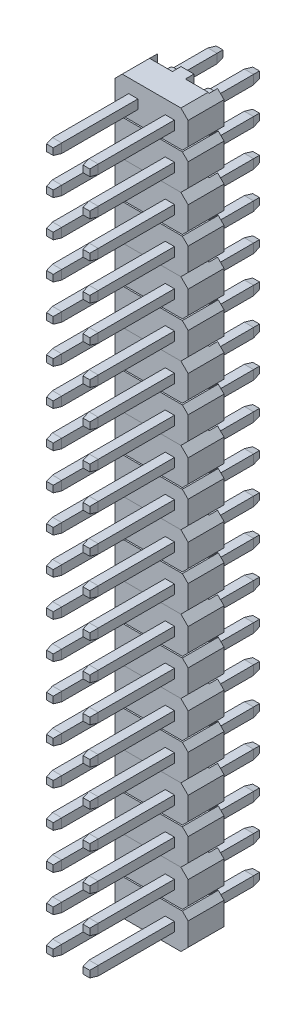
from build123d import *

# Parameters (mm, degrees)
SKETCH1_W                     = 0.64
SKETCH1_H                     = 0.64
BOSS_EXTRUDE1_DEPTH           = 5.3
BOSS_EXTRUDE1_2_DEPTH         = 5.3
BOSS_EXTRUDE1_3_DEPTH         = 5.3
BOSS_EXTRUDE1_4_DEPTH         = 5.3
SKETCH2_W                     = 0.64
SKETCH2_H                     = 0.64
BOSS_EXTRUDE2_DEPTH           = 0.5
BOSS_EXTRUDE2_DRAFT           = 10
BOSS_EXTRUDE2_PROFILE_2_DEPTH = 0.5
BOSS_EXTRUDE2_PROFILE_2_DRAFT = 10
BOSS_EXTRUDE2_PROFILE_3_DEPTH = 0.5
BOSS_EXTRUDE2_PROFILE_3_DRAFT = 10
BOSS_EXTRUDE2_PROFILE_4_DEPTH = 0.5
BOSS_EXTRUDE2_PROFILE_4_DRAFT = 10
BOSS_EXTRUDE3_DEPTH           = 2.5
SKETCH5_W                     = 1.64
SKETCH5_H                     = 5.08
CUT_EXTRUDE1_DEPTH            = 0.6
SKETCH6_W                     = 5.08
SKETCH6_H                     = 0.1
CUT_EXTRUDE2_DEPTH            = 7.822257691
CUT_EXTRUDE3_DEPTH            = 7.822257691
SKETCH8_W                     = 0.64
SKETCH8_H                     = 0.64
BOSS_EXTRUDE4_DEPTH           = 3.6
BOSS_EXTRUDE4_2_DEPTH         = 3.6
BOSS_EXTRUDE4_3_DEPTH         = 3.6
BOSS_EXTRUDE4_4_DEPTH         = 3.6
SKETCH9_W                     = 0.64
SKETCH9_H                     = 0.64
BOSS_EXTRUDE5_DEPTH           = 0.5
BOSS_EXTRUDE5_DRAFT           = 10
BOSS_EXTRUDE5_PROFILE_2_DEPTH = 0.5
BOSS_EXTRUDE5_PROFILE_2_DRAFT = 10
BOSS_EXTRUDE5_PROFILE_3_DEPTH = 0.5
BOSS_EXTRUDE5_PROFILE_3_DRAFT = 10
BOSS_EXTRUDE5_PROFILE_4_DEPTH = 0.5
BOSS_EXTRUDE5_PROFILE_4_DRAFT = 10
LPATTERN1_COUNT               = 10
LPATTERN1_PITCH               = 5.08
SKETCH10_R                    = 0.56
BOSS_EXTRUDE6_DEPTH           = 1
BOSS_EXTRUDE6_2_DEPTH         = 1


with BuildPart() as part:
    # Sketch1 → Boss-Extrude1 (new body)
    with BuildSketch(Plane.XY):
        with Locations((-1.27, 1.27)):
            Rectangle(SKETCH1_W, SKETCH1_H)
    extrude(amount=BOSS_EXTRUDE1_DEPTH)


with BuildPart() as body_2:
    # Sketch1 → Boss-Extrude1 2 (new body)
    with BuildSketch(Plane.XY):
        with Locations((-1.27, -1.27)):
            Rectangle(SKETCH1_W, SKETCH1_H)
    extrude(amount=BOSS_EXTRUDE1_2_DEPTH)


with BuildPart() as body_3:
    # Sketch1 → Boss-Extrude1 3 (new body)
    with BuildSketch(Plane.XY):
        with Locations((1.27, 1.27)):
            Rectangle(SKETCH1_W, SKETCH1_H)
    extrude(amount=BOSS_EXTRUDE1_3_DEPTH)


with BuildPart() as body_4:
    # Sketch1 → Boss-Extrude1 4 (new body)
    with BuildSketch(Plane.XY):
        with Locations((1.27, -1.27)):
            Rectangle(SKETCH1_W, SKETCH1_H)
    extrude(amount=BOSS_EXTRUDE1_4_DEPTH)


with BuildPart() as boss_extrude2_tool:
    # Sketch2 → Boss-Extrude2 (with draft: the straight prism first)
    with BuildSketch(Plane.XY.offset(5.3)):
        with Locations((-1.27, -1.27)):
            Rectangle(SKETCH2_W, SKETCH2_H)
    extrude(amount=BOSS_EXTRUDE2_DEPTH)
    # Boss-Extrude2: the draft: its side faces are tilted about the plane it starts from
    boss_extrude2_sides = [boss_extrude2_tool.faces().sort_by_distance(p)[0] for p in [
        (-1.59, -1.27, 5.55),
        (-1.27, -1.59, 5.55),
        (-0.95, -1.27, 5.55),
        (-1.27, -0.95, 5.55),
    ]]
    draft(boss_extrude2_sides, Plane.XY.offset(5.3), BOSS_EXTRUDE2_DRAFT)


with BuildPart() as part_1:
    add(part.part)

    # Boss-Extrude2: add boss_extrude2_tool
    add(boss_extrude2_tool.part)

    add(body_2.part)  # Boss-Extrude2 merges body 2

    add(body_3.part)  # Boss-Extrude2 merges body 3

    add(body_4.part)  # Boss-Extrude2 merges body 4


with BuildPart() as boss_extrude2_profile_2_tool:
    # Sketch2 → Boss-Extrude2 profile 2 (with draft: the straight prism first)
    with BuildSketch(Plane.XY.offset(5.3)):
        with Locations((-1.27, 1.27)):
            Rectangle(SKETCH2_W, SKETCH2_H)
    extrude(amount=BOSS_EXTRUDE2_PROFILE_2_DEPTH)
    # Boss-Extrude2 profile 2: the draft: its side faces are tilted about the plane it starts from
    boss_extrude2_profile_2_sides = [boss_extrude2_profile_2_tool.faces().sort_by_distance(p)[0] for p in [
        (-1.59, 1.27, 5.55),
        (-1.27, 0.95, 5.55),
        (-0.95, 1.27, 5.55),
        (-1.27, 1.59, 5.55),
    ]]
    draft(boss_extrude2_profile_2_sides, Plane.XY.offset(5.3), BOSS_EXTRUDE2_PROFILE_2_DRAFT)


with BuildPart() as part_2:
    add(part_1.part)

    # Boss-Extrude2 profile 2: add boss_extrude2_profile_2_tool
    add(boss_extrude2_profile_2_tool.part)


with BuildPart() as boss_extrude2_profile_3_tool:
    # Sketch2 → Boss-Extrude2 profile 3 (with draft: the straight prism first)
    with BuildSketch(Plane.XY.offset(5.3)):
        with Locations((1.27, -1.27)):
            Rectangle(SKETCH2_W, SKETCH2_H)
    extrude(amount=BOSS_EXTRUDE2_PROFILE_3_DEPTH)
    # Boss-Extrude2 profile 3: the draft: its side faces are tilted about the plane it starts from
    boss_extrude2_profile_3_sides = [boss_extrude2_profile_3_tool.faces().sort_by_distance(p)[0] for p in [
        (1.59, -1.27, 5.55),
        (1.27, -0.95, 5.55),
        (0.95, -1.27, 5.55),
        (1.27, -1.59, 5.55),
    ]]
    draft(boss_extrude2_profile_3_sides, Plane.XY.offset(5.3), BOSS_EXTRUDE2_PROFILE_3_DRAFT)


with BuildPart() as part_3:
    add(part_2.part)

    # Boss-Extrude2 profile 3: add boss_extrude2_profile_3_tool
    add(boss_extrude2_profile_3_tool.part)


with BuildPart() as boss_extrude2_profile_4_tool:
    # Sketch2 → Boss-Extrude2 profile 4 (with draft: the straight prism first)
    with BuildSketch(Plane.XY.offset(5.3)):
        with Locations((1.27, 1.27)):
            Rectangle(SKETCH2_W, SKETCH2_H)
    extrude(amount=BOSS_EXTRUDE2_PROFILE_4_DEPTH)
    # Boss-Extrude2 profile 4: the draft: its side faces are tilted about the plane it starts from
    boss_extrude2_profile_4_sides = [boss_extrude2_profile_4_tool.faces().sort_by_distance(p)[0] for p in [
        (1.59, 1.27, 5.55),
        (1.27, 1.59, 5.55),
        (0.95, 1.27, 5.55),
        (1.27, 0.95, 5.55),
    ]]
    draft(boss_extrude2_profile_4_sides, Plane.XY.offset(5.3), BOSS_EXTRUDE2_PROFILE_4_DRAFT)


with BuildPart() as part_4:
    add(part_3.part)

    # Boss-Extrude2 profile 4: add boss_extrude2_profile_4_tool
    add(boss_extrude2_profile_4_tool.part)


with BuildPart() as body_2_2:
    # Sketch3 → Boss-Extrude3 (new body)
    with BuildSketch(Plane.XY):
        Polygon((-2.04, 2.54), (2.04, 2.54), (2.54, 2.04), (2.54, -2.04), (2.04, -2.54), (-2.04, -2.54), (-2.54, -2.04), (-2.54, 2.04), align=None)
    extrude(amount=-BOSS_EXTRUDE3_DEPTH)

    # Sketch5 → Cut-Extrude1 (cut)
    with BuildSketch(Plane(origin=(0, 0, -2.5), x_dir=(-1, 0, 0), z_dir=(0, 0, -1))):
        with Locations((-1.27, 0)):
            Rectangle(SKETCH5_W, SKETCH5_H)
        with Locations((1.27, 0)):
            Rectangle(SKETCH5_W, SKETCH5_H)
    extrude(amount=-CUT_EXTRUDE1_DEPTH, mode=Mode.SUBTRACT)

    # Sketch6 → Cut-Extrude2 (cut, through all)
    with BuildSketch(Plane.XY):
        Rectangle(SKETCH6_W, SKETCH6_H)
    extrude(amount=-CUT_EXTRUDE2_DEPTH, mode=Mode.SUBTRACT)


with BuildPart() as cut_extrude2_piece_1:
    # of the separate pieces the step leaves, piece 1, a body of its own (cut_extrude2_pieces)
    add(body_2_2.part.solids().sort_by_distance((-2.04, 2.54, 0))[0])


with BuildPart() as cut_extrude2_piece_2:
    # of the separate pieces the step leaves, piece 2, a body of its own (cut_extrude2_pieces)
    add(body_2_2.part.solids().sort_by_distance((-2.54, -2.04, 0))[0])


with BuildPart() as cut_extrude3_tool:
    # Sketch7 → Cut-Extrude3 (new, through all)
    with BuildSketch(Plane.XY):
        Polygon((2.54, 0.45), (2.14, 0.05), (2.54, 0.05), align=None)
        Polygon((2.54, -0.05), (2.14, -0.05), (2.54, -0.45), align=None)
        Polygon((-2.54, -0.45), (-2.54, -0.05), (-2.14, -0.05), align=None)
        Polygon((-2.54, 0.05), (-2.54, 0.45), (-2.14, 0.05), align=None)
    extrude(amount=-CUT_EXTRUDE3_DEPTH)


with BuildPart() as cut_extrude2_piece_1_1:
    add(cut_extrude2_piece_1.part)

    # Cut-Extrude3: cut by cut_extrude3_tool
    add(cut_extrude3_tool.part, mode=Mode.SUBTRACT)


with BuildPart() as cut_extrude2_piece_2_1:
    add(cut_extrude2_piece_2.part)

    # Cut-Extrude3: cut by cut_extrude3_tool
    add(cut_extrude3_tool.part, mode=Mode.SUBTRACT)


with BuildPart() as body_4_2:
    # Sketch8 → Boss-Extrude4 (new body)
    with BuildSketch(Plane(origin=(0, 0, -1.9), x_dir=(-1, 0, 0), z_dir=(0, 0, -1))):
        with Locations((1.27, -1.27)):
            Rectangle(SKETCH8_W, SKETCH8_H)
    extrude(amount=BOSS_EXTRUDE4_DEPTH)


with BuildPart() as body_5:
    # Sketch8 → Boss-Extrude4 2 (new body)
    with BuildSketch(Plane(origin=(0, 0, -1.9), x_dir=(-1, 0, 0), z_dir=(0, 0, -1))):
        with Locations((1.27, 1.27)):
            Rectangle(SKETCH8_W, SKETCH8_H)
    extrude(amount=BOSS_EXTRUDE4_2_DEPTH)


with BuildPart() as body_6:
    # Sketch8 → Boss-Extrude4 3 (new body)
    with BuildSketch(Plane(origin=(0, 0, -1.9), x_dir=(-1, 0, 0), z_dir=(0, 0, -1))):
        with Locations((-1.27, 1.27)):
            Rectangle(SKETCH8_W, SKETCH8_H)
    extrude(amount=BOSS_EXTRUDE4_3_DEPTH)


with BuildPart() as body_7:
    # Sketch8 → Boss-Extrude4 4 (new body)
    with BuildSketch(Plane(origin=(0, 0, -1.9), x_dir=(-1, 0, 0), z_dir=(0, 0, -1))):
        with Locations((-1.27, -1.27)):
            Rectangle(SKETCH8_W, SKETCH8_H)
    extrude(amount=BOSS_EXTRUDE4_4_DEPTH)


with BuildPart() as boss_extrude5_tool:
    # Sketch9 → Boss-Extrude5 (with draft: the straight prism first)
    with BuildSketch(Plane(origin=(0, 0, -5.5), x_dir=(-1, 0, 0), z_dir=(0, 0, -1))):
        with Locations((1.27, 1.27)):
            Rectangle(SKETCH9_W, SKETCH9_H)
    extrude(amount=BOSS_EXTRUDE5_DEPTH)
    # Boss-Extrude5: the draft: its side faces are tilted about the plane it starts from
    boss_extrude5_sides = [boss_extrude5_tool.faces().sort_by_distance(p)[0] for p in [
        (-0.95, 1.27, -5.75),
        (-1.27, 0.95, -5.75),
        (-1.59, 1.27, -5.75),
        (-1.27, 1.59, -5.75),
    ]]
    draft(boss_extrude5_sides, Plane(origin=(0, 0, -5.5), x_dir=(-1, 0, 0), z_dir=(0, 0, -1)), BOSS_EXTRUDE5_DRAFT)


with BuildPart() as body_5_1:
    add(body_5.part)

    # Boss-Extrude5: add boss_extrude5_tool
    add(boss_extrude5_tool.part)

    add(body_4_2.part)  # Boss-Extrude5 merges body 4 2

    add(body_7.part)  # Boss-Extrude5 merges body 7

    add(body_6.part)  # Boss-Extrude5 merges body 6


with BuildPart() as boss_extrude5_profile_2_tool:
    # Sketch9 → Boss-Extrude5 profile 2 (with draft: the straight prism first)
    with BuildSketch(Plane(origin=(0, 0, -5.5), x_dir=(-1, 0, 0), z_dir=(0, 0, -1))):
        with Locations((1.27, -1.27)):
            Rectangle(SKETCH9_W, SKETCH9_H)
    extrude(amount=BOSS_EXTRUDE5_PROFILE_2_DEPTH)
    # Boss-Extrude5 profile 2: the draft: its side faces are tilted about the plane it starts from
    boss_extrude5_profile_2_sides = [boss_extrude5_profile_2_tool.faces().sort_by_distance(p)[0] for p in [
        (-1.59, -1.27, -5.75),
        (-1.27, -0.95, -5.75),
        (-0.95, -1.27, -5.75),
        (-1.27, -1.59, -5.75),
    ]]
    draft(boss_extrude5_profile_2_sides, Plane(origin=(0, 0, -5.5), x_dir=(-1, 0, 0), z_dir=(0, 0, -1)), BOSS_EXTRUDE5_PROFILE_2_DRAFT)


with BuildPart() as body_5_2:
    add(body_5_1.part)

    # Boss-Extrude5 profile 2: add boss_extrude5_profile_2_tool
    add(boss_extrude5_profile_2_tool.part)


with BuildPart() as boss_extrude5_profile_3_tool:
    # Sketch9 → Boss-Extrude5 profile 3 (with draft: the straight prism first)
    with BuildSketch(Plane(origin=(0, 0, -5.5), x_dir=(-1, 0, 0), z_dir=(0, 0, -1))):
        with Locations((-1.27, -1.27)):
            Rectangle(SKETCH9_W, SKETCH9_H)
    extrude(amount=BOSS_EXTRUDE5_PROFILE_3_DEPTH)
    # Boss-Extrude5 profile 3: the draft: its side faces are tilted about the plane it starts from
    boss_extrude5_profile_3_sides = [boss_extrude5_profile_3_tool.faces().sort_by_distance(p)[0] for p in [
        (1.59, -1.27, -5.75),
        (1.27, -1.59, -5.75),
        (0.95, -1.27, -5.75),
        (1.27, -0.95, -5.75),
    ]]
    draft(boss_extrude5_profile_3_sides, Plane(origin=(0, 0, -5.5), x_dir=(-1, 0, 0), z_dir=(0, 0, -1)), BOSS_EXTRUDE5_PROFILE_3_DRAFT)


with BuildPart() as body_5_3:
    add(body_5_2.part)

    # Boss-Extrude5 profile 3: add boss_extrude5_profile_3_tool
    add(boss_extrude5_profile_3_tool.part)


with BuildPart() as boss_extrude5_profile_4_tool:
    # Sketch9 → Boss-Extrude5 profile 4 (with draft: the straight prism first)
    with BuildSketch(Plane(origin=(0, 0, -5.5), x_dir=(-1, 0, 0), z_dir=(0, 0, -1))):
        with Locations((-1.27, 1.27)):
            Rectangle(SKETCH9_W, SKETCH9_H)
    extrude(amount=BOSS_EXTRUDE5_PROFILE_4_DEPTH)
    # Boss-Extrude5 profile 4: the draft: its side faces are tilted about the plane it starts from
    boss_extrude5_profile_4_sides = [boss_extrude5_profile_4_tool.faces().sort_by_distance(p)[0] for p in [
        (0.95, 1.27, -5.75),
        (1.27, 1.59, -5.75),
        (1.59, 1.27, -5.75),
        (1.27, 0.95, -5.75),
    ]]
    draft(boss_extrude5_profile_4_sides, Plane(origin=(0, 0, -5.5), x_dir=(-1, 0, 0), z_dir=(0, 0, -1)), BOSS_EXTRUDE5_PROFILE_4_DRAFT)


with BuildPart() as body_5_4:
    add(body_5_3.part)

    # Boss-Extrude5 profile 4: add boss_extrude5_profile_4_tool
    add(boss_extrude5_profile_4_tool.part)


with BuildPart() as lpattern1_1:
    # LPattern1: pattern copy
    add(part_4.part.moved(Location(Vector(0, -1, 0) * (1 * LPATTERN1_PITCH))))


with BuildPart() as lpattern1_2:
    # LPattern1: pattern copy
    add(part_4.part.moved(Location(Vector(0, -1, 0) * (2 * LPATTERN1_PITCH))))


with BuildPart() as lpattern1_3:
    # LPattern1: pattern copy
    add(part_4.part.moved(Location(Vector(0, -1, 0) * (3 * LPATTERN1_PITCH))))


with BuildPart() as lpattern1_4:
    # LPattern1: pattern copy
    add(part_4.part.moved(Location(Vector(0, -1, 0) * (4 * LPATTERN1_PITCH))))


with BuildPart() as lpattern1_5:
    # LPattern1: pattern copy
    add(part_4.part.moved(Location(Vector(0, -1, 0) * (5 * LPATTERN1_PITCH))))


with BuildPart() as lpattern1_6:
    # LPattern1: pattern copy
    add(part_4.part.moved(Location(Vector(0, -1, 0) * (6 * LPATTERN1_PITCH))))


with BuildPart() as lpattern1_7:
    # LPattern1: pattern copy
    add(part_4.part.moved(Location(Vector(0, -1, 0) * (7 * LPATTERN1_PITCH))))


with BuildPart() as lpattern1_8:
    # LPattern1: pattern copy
    add(part_4.part.moved(Location(Vector(0, -1, 0) * (8 * LPATTERN1_PITCH))))


with BuildPart() as lpattern1_9:
    # LPattern1: pattern copy
    add(part_4.part.moved(Location(Vector(0, -1, 0) * (9 * LPATTERN1_PITCH))))


with BuildPart() as lpattern1_10:
    # LPattern1: pattern copy
    add(body_5_4.part.moved(Location(Vector(0, -1, 0) * (1 * LPATTERN1_PITCH))))


with BuildPart() as lpattern1_11:
    # LPattern1: pattern copy
    add(body_5_4.part.moved(Location(Vector(0, -1, 0) * (2 * LPATTERN1_PITCH))))


with BuildPart() as lpattern1_12:
    # LPattern1: pattern copy
    add(body_5_4.part.moved(Location(Vector(0, -1, 0) * (3 * LPATTERN1_PITCH))))


with BuildPart() as lpattern1_13:
    # LPattern1: pattern copy
    add(body_5_4.part.moved(Location(Vector(0, -1, 0) * (4 * LPATTERN1_PITCH))))


with BuildPart() as lpattern1_14:
    # LPattern1: pattern copy
    add(body_5_4.part.moved(Location(Vector(0, -1, 0) * (5 * LPATTERN1_PITCH))))


with BuildPart() as lpattern1_15:
    # LPattern1: pattern copy
    add(body_5_4.part.moved(Location(Vector(0, -1, 0) * (6 * LPATTERN1_PITCH))))


with BuildPart() as lpattern1_16:
    # LPattern1: pattern copy
    add(body_5_4.part.moved(Location(Vector(0, -1, 0) * (7 * LPATTERN1_PITCH))))


with BuildPart() as lpattern1_17:
    # LPattern1: pattern copy
    add(body_5_4.part.moved(Location(Vector(0, -1, 0) * (8 * LPATTERN1_PITCH))))


with BuildPart() as lpattern1_18:
    # LPattern1: pattern copy
    add(body_5_4.part.moved(Location(Vector(0, -1, 0) * (9 * LPATTERN1_PITCH))))


with BuildPart() as lpattern1_19:
    # LPattern1: pattern copy
    add(cut_extrude2_piece_2_1.part.moved(Location(Vector(0, -1, 0) * (1 * LPATTERN1_PITCH))))


with BuildPart() as lpattern1_20:
    # LPattern1: pattern copy
    add(cut_extrude2_piece_2_1.part.moved(Location(Vector(0, -1, 0) * (2 * LPATTERN1_PITCH))))


with BuildPart() as lpattern1_21:
    # LPattern1: pattern copy
    add(cut_extrude2_piece_2_1.part.moved(Location(Vector(0, -1, 0) * (3 * LPATTERN1_PITCH))))


with BuildPart() as lpattern1_22:
    # LPattern1: pattern copy
    add(cut_extrude2_piece_2_1.part.moved(Location(Vector(0, -1, 0) * (4 * LPATTERN1_PITCH))))


with BuildPart() as lpattern1_23:
    # LPattern1: pattern copy
    add(cut_extrude2_piece_2_1.part.moved(Location(Vector(0, -1, 0) * (5 * LPATTERN1_PITCH))))


with BuildPart() as lpattern1_24:
    # LPattern1: pattern copy
    add(cut_extrude2_piece_2_1.part.moved(Location(Vector(0, -1, 0) * (6 * LPATTERN1_PITCH))))


with BuildPart() as lpattern1_25:
    # LPattern1: pattern copy
    add(cut_extrude2_piece_2_1.part.moved(Location(Vector(0, -1, 0) * (7 * LPATTERN1_PITCH))))


with BuildPart() as lpattern1_26:
    # LPattern1: pattern copy
    add(cut_extrude2_piece_2_1.part.moved(Location(Vector(0, -1, 0) * (8 * LPATTERN1_PITCH))))


with BuildPart() as lpattern1_27:
    # LPattern1: pattern copy
    add(cut_extrude2_piece_2_1.part.moved(Location(Vector(0, -1, 0) * (9 * LPATTERN1_PITCH))))


with BuildPart() as lpattern1_28:
    # LPattern1: pattern copy
    add(cut_extrude2_piece_1_1.part.moved(Location(Vector(0, -1, 0) * (1 * LPATTERN1_PITCH))))


with BuildPart() as lpattern1_29:
    # LPattern1: pattern copy
    add(cut_extrude2_piece_1_1.part.moved(Location(Vector(0, -1, 0) * (2 * LPATTERN1_PITCH))))


with BuildPart() as lpattern1_30:
    # LPattern1: pattern copy
    add(cut_extrude2_piece_1_1.part.moved(Location(Vector(0, -1, 0) * (3 * LPATTERN1_PITCH))))


with BuildPart() as lpattern1_31:
    # LPattern1: pattern copy
    add(cut_extrude2_piece_1_1.part.moved(Location(Vector(0, -1, 0) * (4 * LPATTERN1_PITCH))))


with BuildPart() as lpattern1_32:
    # LPattern1: pattern copy
    add(cut_extrude2_piece_1_1.part.moved(Location(Vector(0, -1, 0) * (5 * LPATTERN1_PITCH))))


with BuildPart() as lpattern1_33:
    # LPattern1: pattern copy
    add(cut_extrude2_piece_1_1.part.moved(Location(Vector(0, -1, 0) * (6 * LPATTERN1_PITCH))))


with BuildPart() as lpattern1_34:
    # LPattern1: pattern copy
    add(cut_extrude2_piece_1_1.part.moved(Location(Vector(0, -1, 0) * (7 * LPATTERN1_PITCH))))


with BuildPart() as lpattern1_35:
    # LPattern1: pattern copy
    add(cut_extrude2_piece_1_1.part.moved(Location(Vector(0, -1, 0) * (8 * LPATTERN1_PITCH))))


with BuildPart() as lpattern1_36:
    # LPattern1: pattern copy
    add(cut_extrude2_piece_1_1.part.moved(Location(Vector(0, -1, 0) * (9 * LPATTERN1_PITCH))))


with BuildPart() as body_41:
    # Sketch10 → Boss-Extrude6 (new body)
    with BuildSketch(Plane(origin=(0, 0, -1.9), x_dir=(-1, 0, 0), z_dir=(0, 0, -1))):
        with Locations((-1.27, 1.27)):
            Circle(SKETCH10_R)
    extrude(amount=BOSS_EXTRUDE6_DEPTH)


with BuildPart() as body_42:
    # Sketch10 → Boss-Extrude6 2 (new body)
    with BuildSketch(Plane(origin=(0, 0, -1.9), x_dir=(-1, 0, 0), z_dir=(0, 0, -1))):
        with Locations((1.27, 1.27)):
            Circle(SKETCH10_R)
    extrude(amount=BOSS_EXTRUDE6_2_DEPTH)


solid = Compound([part_4.part, cut_extrude2_piece_1_1.part, cut_extrude2_piece_2_1.part, body_5_4.part, lpattern1_1.part, lpattern1_2.part, lpattern1_3.part, lpattern1_4.part, lpattern1_5.part, lpattern1_6.part, lpattern1_7.part, lpattern1_8.part, lpattern1_9.part, lpattern1_10.part, lpattern1_11.part, lpattern1_12.part, lpattern1_13.part, lpattern1_14.part, lpattern1_15.part, lpattern1_16.part, lpattern1_17.part, lpattern1_18.part, lpattern1_19.part, lpattern1_20.part, lpattern1_21.part, lpattern1_22.part, lpattern1_23.part, lpattern1_24.part, lpattern1_25.part, lpattern1_26.part, lpattern1_27.part, lpattern1_28.part, lpattern1_29.part, lpattern1_30.part, lpattern1_31.part, lpattern1_32.part, lpattern1_33.part, lpattern1_34.part, lpattern1_35.part, lpattern1_36.part, body_41.part, body_42.part])
